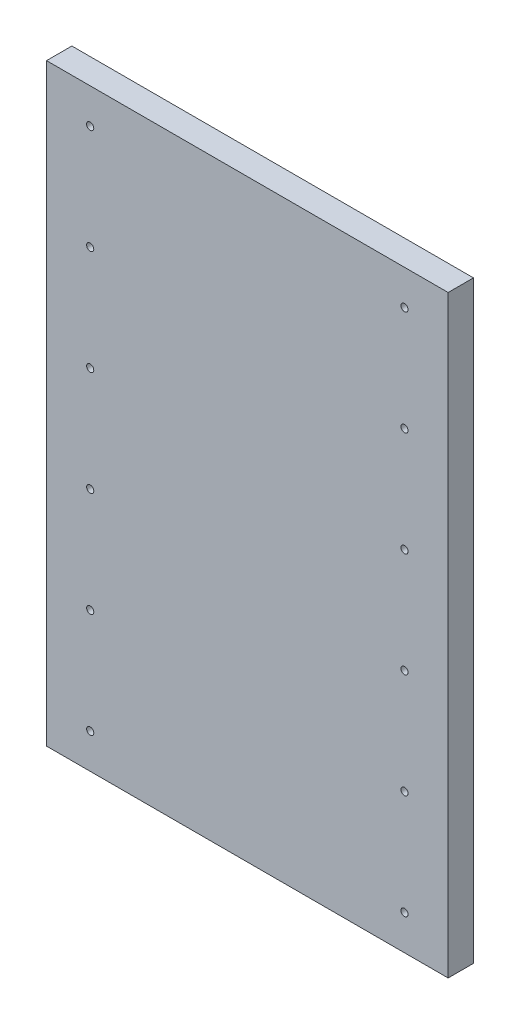
from build123d import *

# Parameters (mm, degrees)
ESQUISSE1_W                  = 230
ESQUISSE1_H                  = 340
BOSS_EXTRU_1_DEPTH           = 14.5
ENL_V_MAT_EXTRU_1_DEPTH      = 411.74353312
ENL_V_MAT_EXTRU_1_DEPTH_BACK = 411.74353312
ESQUISSE2_R                  = 2.05


with BuildPart() as part:
    # Esquisse1 → Boss.-Extru.1 (new body)
    with BuildSketch(Plane.XY):
        with Locations((115, 170)):
            Rectangle(ESQUISSE1_W, ESQUISSE1_H)
    extrude(amount=BOSS_EXTRU_1_DEPTH)

    # Esquisse2 → Enlèv. mat.-Extru.1 (cut, two sides: drawn at the far end of the back side and taken through both)
    with BuildSketch(Plane.XY.offset(14.5).offset(-ENL_V_MAT_EXTRU_1_DEPTH_BACK)):
        with Locations((25, 20)):
            Circle(ESQUISSE2_R)
        with Locations((25, 80)):
            Circle(ESQUISSE2_R)
        with Locations((25, 140)):
            Circle(ESQUISSE2_R)
        with Locations((25, 200)):
            Circle(ESQUISSE2_R)
        with Locations((25, 260)):
            Circle(ESQUISSE2_R)
        with Locations((25, 320)):
            Circle(ESQUISSE2_R)
        with Locations((205, 320)):
            Circle(ESQUISSE2_R)
        with Locations((205, 260)):
            Circle(ESQUISSE2_R)
        with Locations((205, 200)):
            Circle(ESQUISSE2_R)
        with Locations((205, 140)):
            Circle(ESQUISSE2_R)
        with Locations((205, 80)):
            Circle(ESQUISSE2_R)
        with Locations((205, 20)):
            Circle(ESQUISSE2_R)
    extrude(amount=ENL_V_MAT_EXTRU_1_DEPTH + ENL_V_MAT_EXTRU_1_DEPTH_BACK, mode=Mode.SUBTRACT)


solid = part.part
